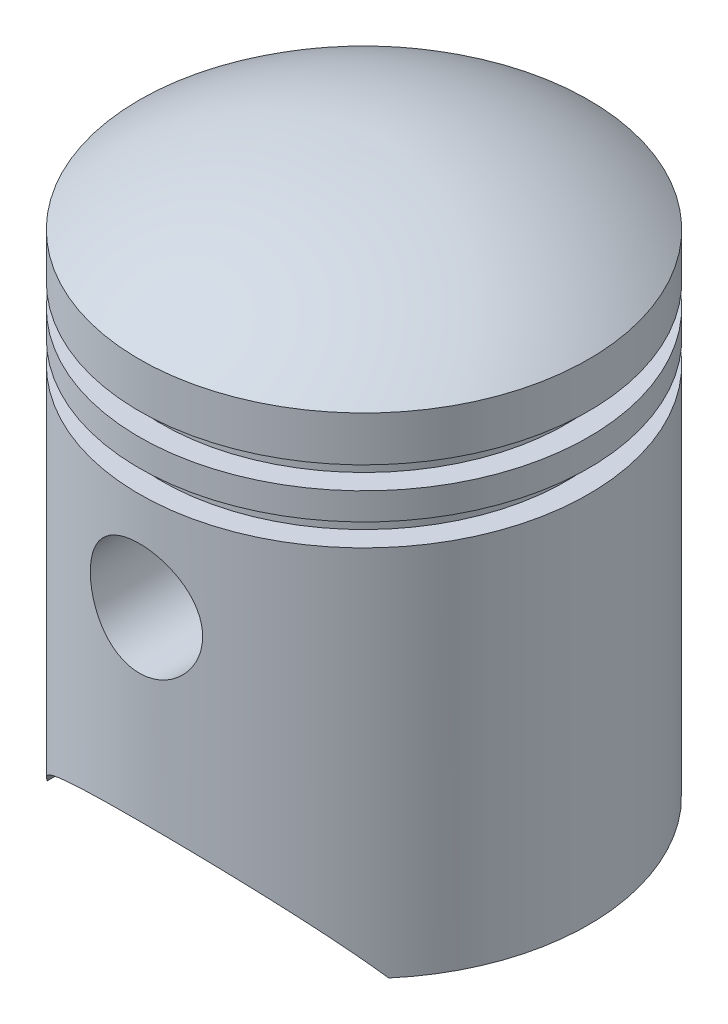
from build123d import *

# Parameters (mm, degrees)
CUT_EXTRUDE1_DEPTH       = 72.817566835
CUT_EXTRUDE1_DEPTH_BACK  = 72.817566835
SKETCH2_R                = 6.25
BOSS_EXTRUDE3_REACH      = 85.818
BOSS_EXTRUDE3_END_RADIUS = 23
BOSS_EXTRUDE3_START      = 12
SKETCH3_R                = 7.25
SKETCH3_R_2              = 6.25


with BuildPart() as part:
    # Sketch1 → Revolve1 (revolve)
    with BuildSketch(Plane.XY, mode=Mode.PRIVATE) as revolve1_sk:
        with BuildLine():
            Line((25, 0), (25, 41.5))
            Line((25, 41.5), (22.5, 41.5))
            Line((22.5, 41.5), (22.5, 44))
            Line((22.5, 44), (25, 44))
            Line((25, 44), (25, 47))
            Line((25, 47), (22.5, 47))
            Line((22.5, 47), (22.5, 49.5))
            Line((22.5, 49.5), (25, 49.5))
            Line((25, 49.5), (25, 54.5))
            ThreePointArc((25, 54.5), (13.174901691, 60.609067785), (0, 62.5))
            Line((0, 62.5), (0, 60.49936285))
            ThreePointArc((0, 60.49936285), (12.069492637, 58.859165445), (23, 53.484511145))
            Line((23, 53.484511145), (23, 51.5))
            Line((23, 51.5), (20.5, 51.5))
            Line((20.5, 51.5), (20.5, 45.5))
            Line((20.5, 45.5), (20.5, 39.5))
            Line((20.5, 39.5), (23, 39.5))
            Line((23, 39.5), (23, 0))
            Line((23, 0), (25, 0))
        make_face()
    revolve(revolve1_sk.sketch.rotate(Axis((0, 62.5, 0), (0, -1, 0)), 180), axis=Axis((0, 62.5, 0), (0, -1, 0)))

    # Sketch2 → Cut-Extrude1 (cut, two sides: drawn at the far end of the back side and taken through both)
    with BuildSketch(Plane.XY.offset(-CUT_EXTRUDE1_DEPTH_BACK)):
        with Locations((0, 30.5)):
            Circle(SKETCH2_R)
        with BuildLine():
            Line((-19, 0), (19, 0))
            ThreePointArc((19, 0), (0, 10), (-19, 0))
        make_face()
    extrude(amount=CUT_EXTRUDE1_DEPTH + CUT_EXTRUDE1_DEPTH_BACK, mode=Mode.SUBTRACT)

    # Boss-Extrude3: up to this cylinder (the profile starts inside it)
    boss_extrude3_end = Plane(origin=(0, 30.5, 0), z_dir=(0, 1, 0)) * Cylinder(BOSS_EXTRUDE3_END_RADIUS, 218.636, mode=Mode.PRIVATE)
    # Sketch3 → Boss-Extrude3 (add, up to the surface)
    with BuildSketch(Plane.XY.offset(BOSS_EXTRUDE3_START), mode=Mode.PRIVATE) as boss_extrude3_sk1:
        with Locations(Location((0, 30.5, 0), (0, 0, 180))):
            Circle(SKETCH3_R)
        with Locations((0, 30.5)):
            Circle(SKETCH3_R_2, mode=Mode.SUBTRACT)
    boss_extrude3_tool1 = extrude(boss_extrude3_sk1.sketch, amount=BOSS_EXTRUDE3_REACH, mode=Mode.PRIVATE) & boss_extrude3_end
    boss_extrude3 = boss_extrude3_tool1.solids().sort_by_distance((7.044939, 30.5, 12))[0]
    add(boss_extrude3)

    # Mirror2: Boss-Extrude3 across plane
    add(boss_extrude3.mirror(Plane.XY))


solid = part.part
